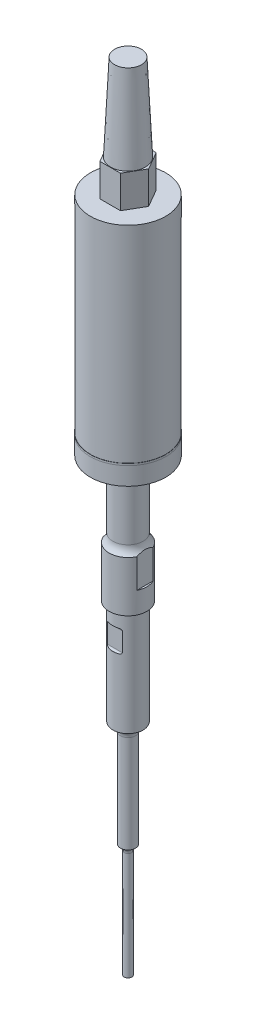
from build123d import *

# Parameters (mm, degrees)
CUT_EXTRUDE1_DEPTH      = 286.633670547
CUT_EXTRUDE1_DEPTH_BACK = 286.633670547
CUT_EXTRUDE2_DEPTH      = 286.633670547
CUT_EXTRUDE2_DEPTH_BACK = 286.633670547
BOSS_EXTRUDE1_DEPTH     = 13.7
SKETCH7_W               = 0.1
SKETCH7_H               = 0.8


with BuildPart() as part:
    # Sketch1 → Revolve1 (revolve)
    with BuildSketch(Plane.XY):
        with BuildLine():
            Line((0, 0), (15.875, 0))
            Line((15.875, 0), (15.875, -95.25))
            Line((15.875, -95.25), (7.75, -95.25))
            ThreePointArc((7.75, -95.25), (6.710108543, -97.13103799), (6.35, -99.25))
            Line((6.35, -99.25), (6.35, -123.35))
            ThreePointArc((6.35, -123.35), (6.765423592, -125.271598049), (7.9375, -126.85))
            Line((7.9375, -126.85), (7.9375, -148.15))
            Line((7.9375, -148.15), (6.35, -148.15))
            Line((6.35, -148.15), (6.35, -192.25))
            ThreePointArc((6.35, -192.25), (4.060973326, -193.504085038), (3.15, -195.95))
            Line((3.15, -195.95), (3.15, -236.95))
            ThreePointArc((3.15, -236.95), (2.021186638, -237.921495537), (1.6, -239.35))
            Line((1.6, -239.35), (1.6, -284.75))
            Line((1.6, -284.75), (0, -284.75))
            Line((0, -284.75), (0, 0))
        make_face()
    revolve(axis=Axis((0, -284.75, 0), (0, 1, 0)))

    # Sketch3 → Cut-Extrude1 (cut, two sides: drawn at the far end of the back side and taken through both)
    with BuildSketch(Plane.XY.offset(-CUT_EXTRUDE1_DEPTH_BACK)):
        with BuildLine():
            Line((7.9375, -139.15), (7.9375, -126.85))
            ThreePointArc((7.9375, -126.85), (7.511434792, -126.425239776), (7.14375, -125.949045798))
            Line((7.14375, -125.949045798), (7.14375, -139.15))
            Line((7.14375, -139.15), (7.9375, -139.15))
        make_face()
        with BuildLine():
            Line((-7.14375, -139.15), (-7.14375, -125.949045798))
            ThreePointArc((-7.14375, -125.949045798), (-7.511434792, -126.425239776), (-7.9375, -126.85))
            Line((-7.9375, -126.85), (-7.9375, -139.15))
            Line((-7.9375, -139.15), (-7.14375, -139.15))
        make_face()
    extrude(amount=CUT_EXTRUDE1_DEPTH + CUT_EXTRUDE1_DEPTH_BACK, mode=Mode.SUBTRACT)

    # Sketch4 → Cut-Extrude2 (cut, two sides: drawn at the far end of the back side and taken through both)
    with BuildSketch(Plane(origin=(0, 0, 0), x_dir=(0, 0, -1), z_dir=(1, 0, 0)).offset(-CUT_EXTRUDE2_DEPTH_BACK)):
        with BuildLine():
            Line((6.35, -163.5805), (6.2245, -163.5805))
            ThreePointArc((6.2245, -163.5805), (5.729525253, -163.375474747), (5.5245, -162.8805))
            Line((5.5245, -162.8805), (5.5245, -154.8825))
            ThreePointArc((5.5245, -154.8825), (5.729525253, -154.387525253), (6.2245, -154.1825))
            Line((6.2245, -154.1825), (6.35, -154.1825))
            Line((6.35, -154.1825), (6.35, -163.5805))
        make_face()
        with BuildLine():
            Line((-5.5245, -162.8805), (-5.5245, -154.8825))
            ThreePointArc((-5.5245, -154.8825), (-5.729525253, -154.387525253), (-6.2245, -154.1825))
            Line((-6.2245, -154.1825), (-6.35, -154.1825))
            Line((-6.35, -154.1825), (-6.35, -163.5805))
            Line((-6.35, -163.5805), (-6.2245, -163.5805))
            ThreePointArc((-6.2245, -163.5805), (-5.729525253, -163.375474747), (-5.5245, -162.8805))
        make_face()
    extrude(amount=CUT_EXTRUDE2_DEPTH + CUT_EXTRUDE2_DEPTH_BACK, mode=Mode.SUBTRACT)

    # Sketch5 → Boss-Extrude1 (add)
    with BuildSketch(Plane(origin=(0, 0, 0), x_dir=(1, 0, 0), z_dir=(0, 1, 0))):
        Polygon((-4.33708409, 7.51205), (-8.674168179, 0), (-4.33708409, -7.51205), (4.33708409, -7.51205), (8.674168179, 0), (4.33708409, 7.51205), align=None)
    extrude(amount=BOSS_EXTRUDE1_DEPTH)

    # Sketch6 → Revolve2 (revolve)
    with BuildSketch(Plane.XY, mode=Mode.PRIVATE) as revolve2_sk:
        Polygon((7.35, 13.7), (0, 13.7), (0, 50.2), (5.65, 50.2), align=None)
    revolve(revolve2_sk.sketch.rotate(Axis((0, 13.7, 0), (0, 1, 0)), 90), axis=Axis((0, 13.7, 0), (0, 1, 0)))

    # Sketch7 → Revolve3 (revolve)
    with BuildSketch(Plane.XY):
        with Locations((15.925, -87.25)):
            Rectangle(SKETCH7_W, SKETCH7_H)
    revolve(axis=Axis((0, -284.75, 0), (0, 1, 0)))


solid = part.part
